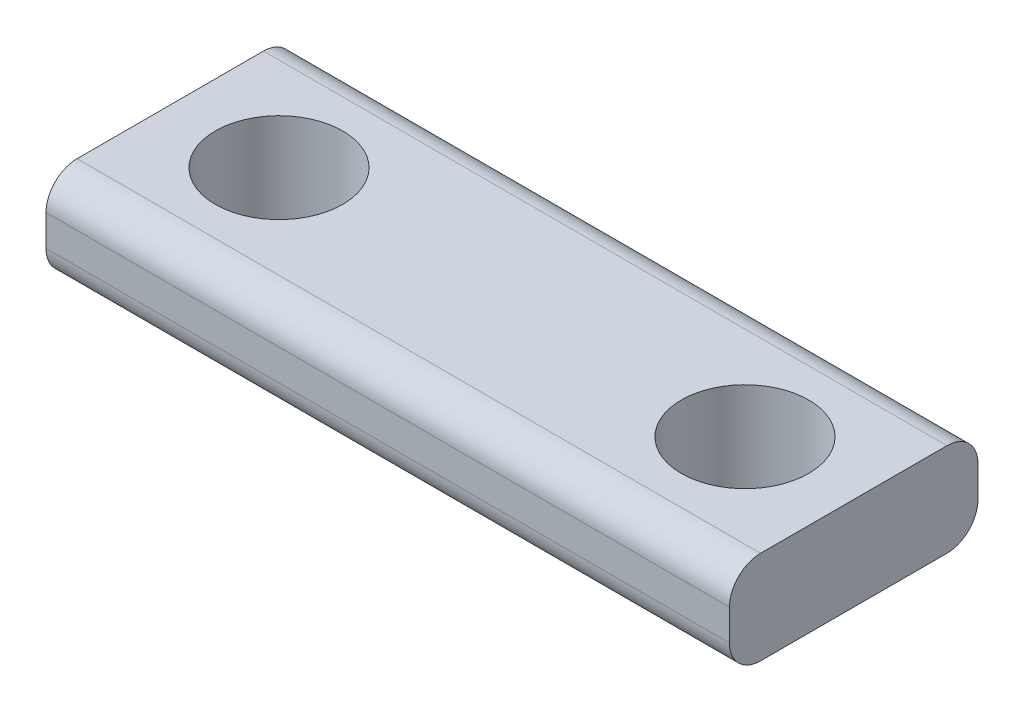
from build123d import *

# Parameters (mm, degrees)
SKETCH1_W           = 22
SKETCH1_H           = 8
SKETCH1_R           = 2.05
BOSS_EXTRUDE1_DEPTH = 3
FILLET1_R           = 1


with BuildPart() as part:
    # Sketch1 → Boss-Extrude1 (new body)
    with BuildSketch(Plane(origin=(0, 0, 0), x_dir=(1, 0, 0), z_dir=(0, 1, 0))):
        with Locations((11, 4)):
            Rectangle(SKETCH1_W, SKETCH1_H)
        with Locations(Location((3.5, 4, 0), (0, 0, 270))):
            Circle(SKETCH1_R, mode=Mode.SUBTRACT)
        with Locations(Location((18.5, 4, 0), (0, 0, 270))):
            Circle(SKETCH1_R, mode=Mode.SUBTRACT)
    extrude(amount=BOSS_EXTRUDE1_DEPTH)

    # Fillet1
    fillet1_edges = [part.edges().sort_by_distance(p)[0] for p in [
        (11, 3, -8),
        (11, 0, -8),
        (11, 0, 0),
        (11, 3, 0),
    ]]
    fillet(fillet1_edges, radius=FILLET1_R)


solid = part.part
